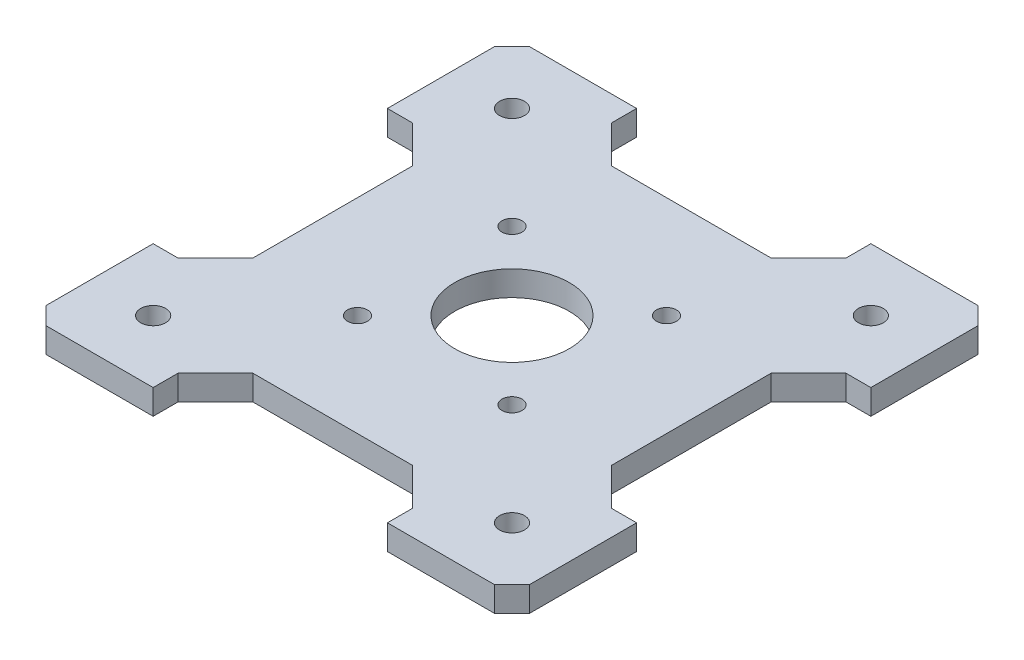
from build123d import *

# Parameters (mm, degrees)
SKETCH1_W           = 72
SKETCH1_H           = 72
BOSS_EXTRUDE1_DEPTH = 5
SKETCH5_W           = 25
SKETCH5_H           = 25
BOSS_EXTRUDE2_DEPTH = 5
SKETCH3_R           = 2
SKETCH3_R_2         = 11.5
SKETCH3_R_3         = 2.5
CUT_EXTRUDE1_DEPTH  = 69.771360318
CHAMFER1_SIZE       = 7.5
CHAMFER2_SIZE       = 3.5


with BuildPart() as part:
    # Sketch1 → Boss-Extrude1 (new body)
    with BuildSketch(Plane(origin=(0, 0, 0), x_dir=(1, 0, 0), z_dir=(0, 1, 0))):
        Rectangle(SKETCH1_W, SKETCH1_H)
    extrude(amount=BOSS_EXTRUDE1_DEPTH)

    # Sketch5 → Boss-Extrude2 (add)
    with BuildSketch(Plane(origin=(0, 5, 0), x_dir=(1, 0, 0), z_dir=(0, 1, 0))):
        with Locations((-36, -36)):
            Rectangle(SKETCH5_W, SKETCH5_H)
        with Locations((36, -36)):
            Rectangle(SKETCH5_W, SKETCH5_H)
        with Locations((36, 36)):
            Rectangle(SKETCH5_W, SKETCH5_H)
        with Locations((-36, 36)):
            Rectangle(SKETCH5_W, SKETCH5_H)
    extrude(amount=-BOSS_EXTRUDE2_DEPTH)

    # Sketch3 → Cut-Extrude1 (cut, through all)
    with BuildSketch(Plane(origin=(0, 5, 0), x_dir=(1, 0, 0), z_dir=(0, 1, 0))):
        with Locations(Location((-15.5, 15.5, 0), (0, 0, 270))):
            Circle(SKETCH3_R)
        with Locations(Location((15.5, 15.5, 0), (0, 0, 270))):
            Circle(SKETCH3_R)
        with Locations(Location((15.5, -15.5, 0), (0, 0, 270))):
            Circle(SKETCH3_R)
        with Locations(Location((-15.5, -15.5, 0), (0, 0, 270))):
            Circle(SKETCH3_R)
        with Locations(Location((0, 0, 0), (0, 0, 270))):
            Circle(SKETCH3_R_2)
        with Locations(Location((-36, -36, 0), (0, 0, 270))):
            Circle(SKETCH3_R_3)
        with Locations(Location((36, -36, 0), (0, 0, 90))):
            Circle(SKETCH3_R_3)
        with Locations(Location((36, 36, 0), (0, 0, 270))):
            Circle(SKETCH3_R_3)
        with Locations(Location((-36, 36, 0), (0, 0, 90))):
            Circle(SKETCH3_R_3)
    extrude(amount=-CUT_EXTRUDE1_DEPTH, mode=Mode.SUBTRACT)

    # Chamfer1
    chamfer1_edges = [part.edges().sort_by_distance(p)[0] for p in [
        (-23.5, 2.5, 36),
        (-36, 2.5, 23.5),
        (36, 2.5, 23.5),
        (23.5, 2.5, 36),
        (36, 2.5, -23.5),
        (23.5, 2.5, -36),
        (-36, 2.5, -23.5),
        (-23.5, 2.5, -36),
    ]]
    chamfer(chamfer1_edges, length=CHAMFER1_SIZE)

    # Chamfer2
    chamfer2_edges = [part.edges().sort_by_distance(p)[0] for p in [
        (-48.5, 2.5, 48.5),
        (48.5, 2.5, 48.5),
        (48.5, 2.5, -48.5),
        (-48.5, 2.5, -48.5),
    ]]
    chamfer(chamfer2_edges, length=CHAMFER2_SIZE)


solid = part.part
